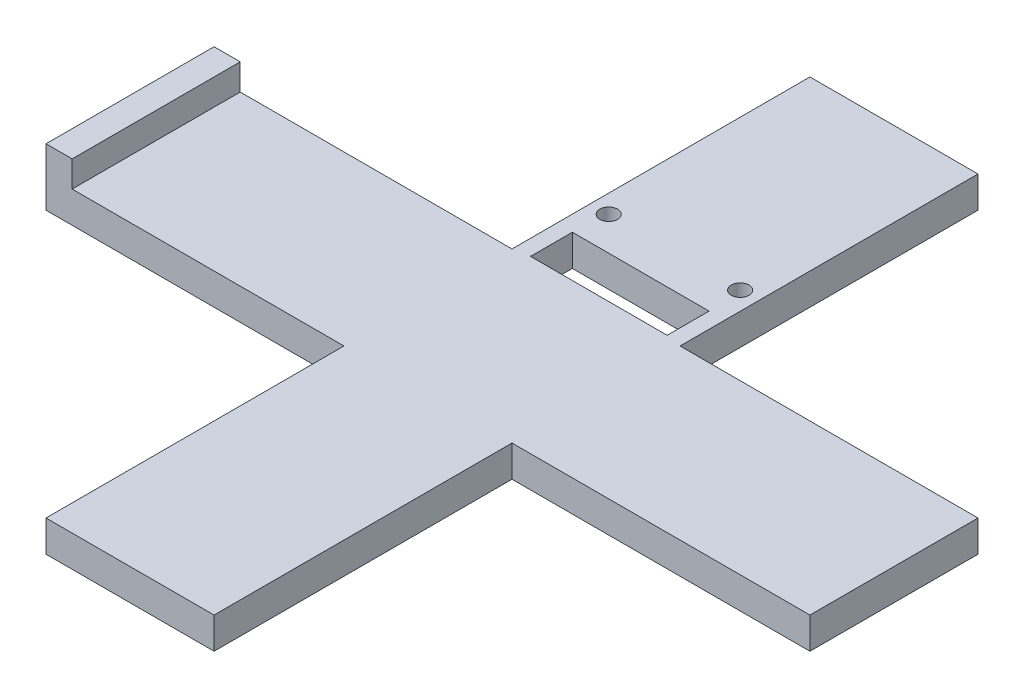
from build123d import *

# Parameters (mm, degrees)
SKETCH21_R           = 1.7
SKETCH21_W           = 26.12
SKETCH21_H           = 8
BOSS_EXTRUDE18_DEPTH = 6
SKETCH22_W           = 5
SKETCH22_H           = 32.12
BOSS_EXTRUDE19_DEPTH = 5


with BuildPart() as part:
    # Sketch21 → Boss-Extrude18 (new body)
    with BuildSketch(Plane(origin=(0, 0, 0), x_dir=(1, 0, 0), z_dir=(0, 1, 0))):
        Polygon((0, 73), (-16.06, 73), (-16.06, 16.06), (-73, 16.06), (-73, 0), (-73, -16.06), (-16.06, -16.06), (-16.06, -73), (0, -73), (16.06, -73), (16.06, -16.06), (73, -16.06), (73, 0), (73, 16.06), (16.06, 16.06), (16.06, 73), align=None)
        with Locations(Location((-12.56, 31.04, 0), (0, 0, 270))):
            Circle(SKETCH21_R, mode=Mode.SUBTRACT)
        with Locations(Location((12.56, 31.04, 0), (0, 0, 270))):
            Circle(SKETCH21_R, mode=Mode.SUBTRACT)
        with Locations((0, 20.6)):
            Rectangle(SKETCH21_W, SKETCH21_H, mode=Mode.SUBTRACT)
    extrude(amount=BOSS_EXTRUDE18_DEPTH)

    # Sketch22 → Boss-Extrude19 (add)
    with BuildSketch(Plane(origin=(0, 6, 0), x_dir=(1, 0, 0), z_dir=(0, 1, 0))):
        with Locations((-70.5, 0)):
            Rectangle(SKETCH22_W, SKETCH22_H)
    extrude(amount=BOSS_EXTRUDE19_DEPTH)


solid = part.part
